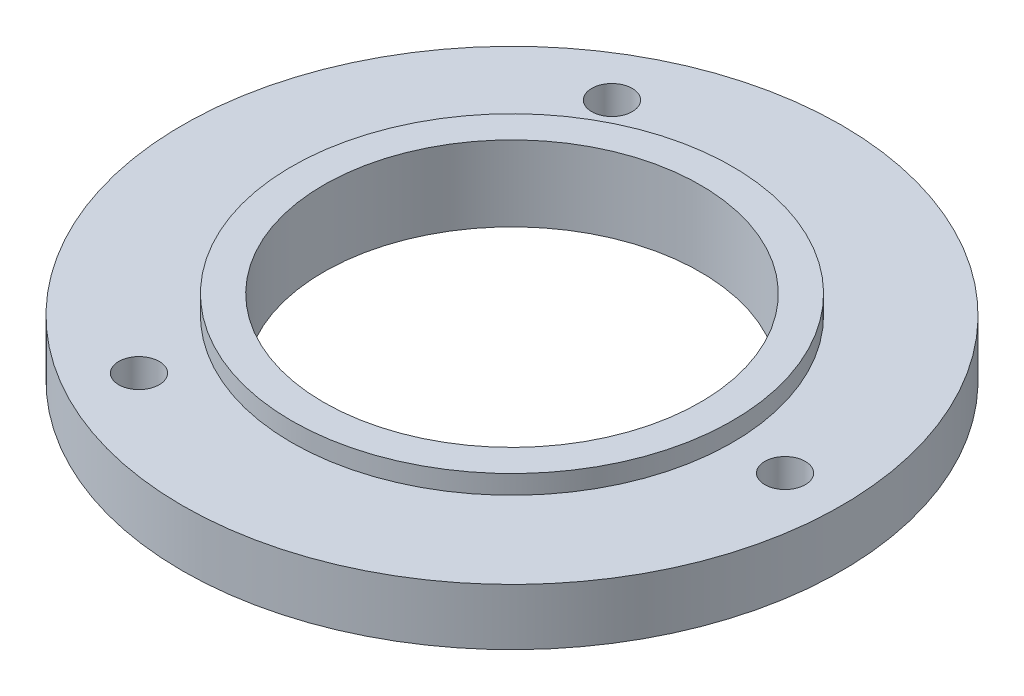
from build123d import *

# Parameters (mm, degrees)
SKETCH_1_R          = 35
SKETCH_1_R_2        = 20
EXTRUDE_1_DEPTH     = 6
SKETCH_2_R          = 2.15
CUT_EXTRUDE_1_DEPTH = 70
FILLET_2_R          = 2
SKETCH_3_R          = 23.4
SKETCH_3_R_2        = 20
EXTRUDE_2_DEPTH     = 2


with BuildPart() as part:
    # 草图1 → 凸台-拉伸1 (new body)
    with BuildSketch(Plane(origin=(0, 0, 0), x_dir=(1, 0, 0), z_dir=(0, 1, 0))):
        with Locations(Location((0, 0, 0), (0, 0, 270))):
            Circle(SKETCH_1_R)
        with Locations(Location((0, 0, 0), (0, 0, 270))):
            Circle(SKETCH_1_R_2, mode=Mode.SUBTRACT)
    extrude(amount=EXTRUDE_1_DEPTH)

    # 草图2 → 切除-拉伸1 (cut)
    with BuildSketch(Plane(origin=(0, 6, 0), x_dir=(1, 0, 0), z_dir=(0, 1, 0))):
        with Locations(Location((29, 0, 0), (0, 0, 270))):
            Circle(SKETCH_2_R)
        with Locations(Location((-14.5, -25.11473671, 0), (0, 0, 270))):
            Circle(SKETCH_2_R)
        with Locations(Location((-14.5, 25.11473671, 0), (0, 0, 270))):
            Circle(SKETCH_2_R)
    extrude(amount=-CUT_EXTRUDE_1_DEPTH, mode=Mode.SUBTRACT)

    # 圆角2
    fillet_2_edges = [part.edges().sort_by_distance(p)[0] for p in [
        (29, 0, -2.15),
        (-14.5, 0, 22.96473671),
        (-14.5, 0, -27.26473671),
    ]]
    fillet(fillet_2_edges, radius=FILLET_2_R)

    # 草图3 → 凸台-拉伸2 (add)
    with BuildSketch(Plane(origin=(0, 6, 0), x_dir=(1, 0, 0), z_dir=(0, 1, 0))):
        with Locations(Location((0, 0, 0), (0, 0, 270))):
            Circle(SKETCH_3_R)
        with Locations(Location((0, 0, 0), (0, 0, 270))):
            Circle(SKETCH_3_R_2, mode=Mode.SUBTRACT)
    extrude(amount=EXTRUDE_2_DEPTH)


solid = part.part
